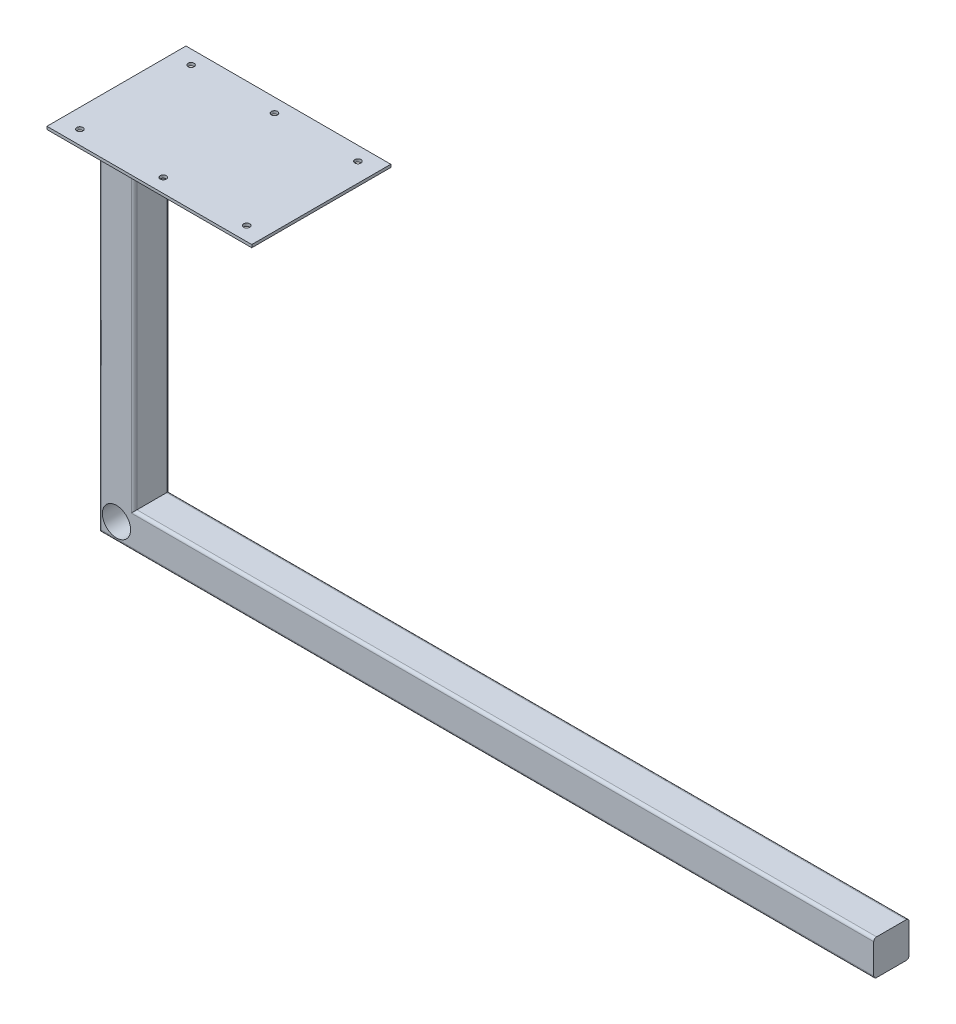
from build123d import *

# Parameters (mm, degrees)
SKETCH1_R                     = 12.7
BOSS_EXTRUDE1_DEPTH           = 31.75
FILLET1_R                     = 2.54
SKETCH3_W                     = 184.15
SKETCH3_H                     = 125
BOSS_EXTRUDE2_DEPTH           = 2.54
M5_CLEARANCE_HOLE1_AT_2_COUNT = 2
M5_CLEARANCE_HOLE1_AT_2_PITCH = 180.277563773
M5_CLEARANCE_HOLE1_AT_3_COUNT = 2
M5_CLEARANCE_HOLE1_AT_3_PITCH = 150
M5_CLEARANCE_HOLE1_AT_4_COUNT = 2
M5_CLEARANCE_HOLE1_AT_4_PITCH = 100
M5_CLEARANCE_HOLE1_AT_5_COUNT = 2
M5_CLEARANCE_HOLE1_AT_5_PITCH = 75
M5_CLEARANCE_HOLE1_AT_6_COUNT = 2
M5_CLEARANCE_HOLE1_AT_6_PITCH = 125


with BuildPart() as part:
    # Sketch1 → Boss-Extrude1 (new body)
    with BuildSketch(Plane.XY):
        Polygon((31.75, 31.75), (645.922, 31.75), (696.722, 31.75), (696.722, 0), (645.922, 0), (0, 0), (0, 336.55), (31.75, 336.55), align=None)
        with Locations((15.875, 15.875)):
            Circle(SKETCH1_R, mode=Mode.SUBTRACT)
    extrude(amount=BOSS_EXTRUDE1_DEPTH)

    # Fillet1
    fillet1_edges = [part.edges().sort_by_distance(p)[0] for p in [
        (348.361, 0, 31.75),
        (0, 168.275, 0),
        (364.236, 31.75, 31.75),
        (31.75, 184.15, 31.75),
        (0, 168.275, 31.75),
        (31.75, 184.15, 0),
        (364.236, 31.75, 0),
        (348.361, 0, 0),
    ]]
    fillet(fillet1_edges, radius=FILLET1_R)

    # Sketch3 → Boss-Extrude2 (add)
    with BuildSketch(Plane(origin=(0, 336.55, 0), x_dir=(1, 0, 0), z_dir=(0, 1, 0))):
        with Locations((92.075, -15.875)):
            Rectangle(SKETCH3_W, SKETCH3_H)
    extrude(amount=BOSS_EXTRUDE2_DEPTH)

    # Sketch8 → M5 Clearance Hole1 (revolve, cut)
    with BuildSketch(Plane(origin=(167.075, 339.09, -34.125), x_dir=(0, 0, 1), z_dir=(1, 0, 0))):
        Polygon((0, 0), (0, 2.54), (2.775, 2.54), (2.75, 2.515), (2.75, 0), align=None)
    m5_clearance_hole1 = revolve(axis=Axis((167.075, 345.44, -34.125), (0, -1, 0)), mode=Mode.SUBTRACT)

    # M5 Clearance Hole1 at 2: M5 Clearance Hole1 ×2
    with Locations(*[Vector(-0.8320502943378437, 0, 0.5547001962252293) * (i * M5_CLEARANCE_HOLE1_AT_2_PITCH) for i in range(1, M5_CLEARANCE_HOLE1_AT_2_COUNT)]):
        add(m5_clearance_hole1, mode=Mode.SUBTRACT)

    # M5 Clearance Hole1 at 3: M5 Clearance Hole1 ×2
    with Locations(*[(-i * M5_CLEARANCE_HOLE1_AT_3_PITCH, 0, 0) for i in range(1, M5_CLEARANCE_HOLE1_AT_3_COUNT)]):
        add(m5_clearance_hole1, mode=Mode.SUBTRACT)

    # M5 Clearance Hole1 at 4: M5 Clearance Hole1 ×2
    with Locations(*[(0, 0, i * M5_CLEARANCE_HOLE1_AT_4_PITCH) for i in range(1, M5_CLEARANCE_HOLE1_AT_4_COUNT)]):
        add(m5_clearance_hole1, mode=Mode.SUBTRACT)

    # M5 Clearance Hole1 at 5: M5 Clearance Hole1 ×2
    with Locations(*[(-i * M5_CLEARANCE_HOLE1_AT_5_PITCH, 0, 0) for i in range(1, M5_CLEARANCE_HOLE1_AT_5_COUNT)]):
        add(m5_clearance_hole1, mode=Mode.SUBTRACT)

    # M5 Clearance Hole1 at 6: M5 Clearance Hole1 ×2
    with Locations(*[Vector(-0.6, 0, 0.8) * (i * M5_CLEARANCE_HOLE1_AT_6_PITCH) for i in range(1, M5_CLEARANCE_HOLE1_AT_6_COUNT)]):
        add(m5_clearance_hole1, mode=Mode.SUBTRACT)


solid = part.part
